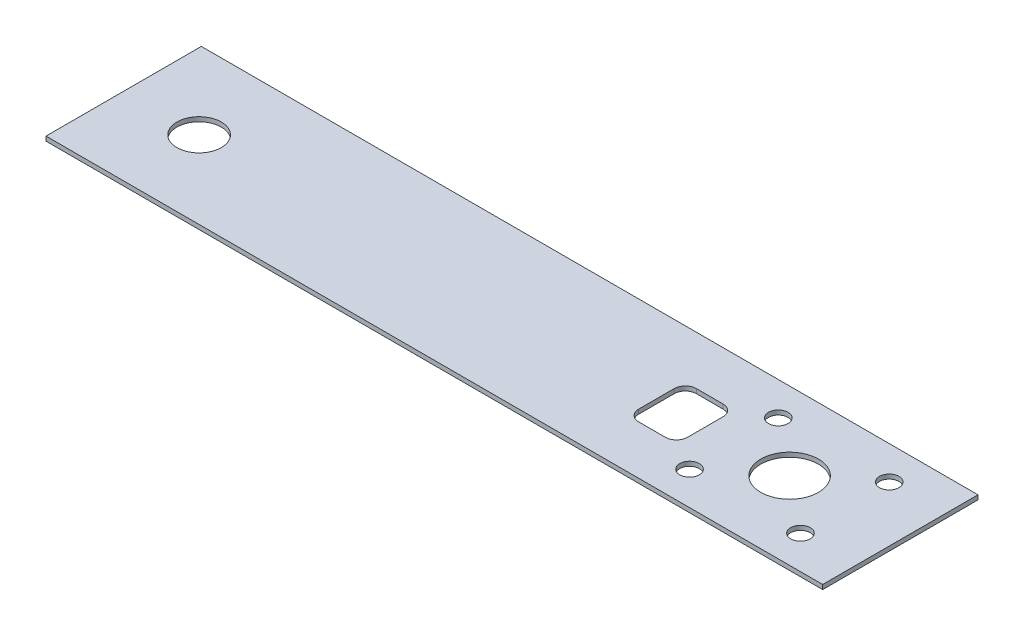
from build123d import *

# Parameters (mm, degrees)
SKETCH1_W           = 350
SKETCH1_H           = 70
SKETCH1_R           = 4.4
BOSS_EXTRUDE1_DEPTH = 2
CUT_EXTRUDE1_REACH  = 180.477
SKETCH2_R           = 13
CUT_EXTRUDE2_REACH  = 180.477
SKETCH3_R           = 10


with BuildPart() as part:
    # Sketch1 → Boss-Extrude1 (new body)
    with BuildSketch(Plane(origin=(0, 0, 0), x_dir=(1, 0, 0), z_dir=(0, 1, 0))):
        Rectangle(SKETCH1_W, SKETCH1_H)
        with Locations(Location((150, 20, 0), (0, 0, 270))):
            Circle(SKETCH1_R, mode=Mode.SUBTRACT)
        with Locations(Location((150, -20, 0), (0, 0, 90))):
            Circle(SKETCH1_R, mode=Mode.SUBTRACT)
        with Locations(Location((100, -20, 0), (0, 0, 270))):
            Circle(SKETCH1_R, mode=Mode.SUBTRACT)
        with Locations(Location((100, 20, 0), (0, 0, 90))):
            Circle(SKETCH1_R, mode=Mode.SUBTRACT)
        with BuildLine():
            Line((82.1, -13), (70.1, -13))
            ThreePointArc((70.1, -13), (66.564466094, -11.535533906), (65.1, -8))
            Line((65.1, -8), (65.1, 8))
            ThreePointArc((65.1, 8), (66.564466094, 11.535533906), (70.1, 13))
            Line((70.1, 13), (82.1, 13))
            ThreePointArc((82.1, 13), (85.635533906, 11.535533906), (87.1, 8))
            Line((87.1, 8), (87.1, -8))
            ThreePointArc((87.1, -8), (85.635533906, -11.535533906), (82.1, -13))
        make_face(mode=Mode.SUBTRACT)
    extrude(amount=BOSS_EXTRUDE1_DEPTH)

    # Sketch2 → Cut-Extrude1 (cut, up to next)
    with BuildSketch(Plane(origin=(0, 0, 0), x_dir=(1, 0, 0), z_dir=(0, 1, 0)), mode=Mode.PRIVATE) as cut_extrude1_sk1:
        with Locations(Location((125.1, 0, 0), (0, 0, 90))):
            Circle(SKETCH2_R)
    cut_extrude1_tool1 = extrude(cut_extrude1_sk1.sketch, amount=CUT_EXTRUDE1_REACH, mode=Mode.PRIVATE) & part.part
    add(cut_extrude1_tool1.solids().sort_by_distance((125.1, 0, 0))[0], mode=Mode.SUBTRACT)

    # Sketch3 → Cut-Extrude2 (cut, up to next)
    with BuildSketch(Plane(origin=(0, 0, 0), x_dir=(1, 0, 0), z_dir=(0, 1, 0)), mode=Mode.PRIVATE) as cut_extrude2_sk1:
        with Locations(Location((-141, 0, 0), (0, 0, 90))):
            Circle(SKETCH3_R)
    cut_extrude2_tool1 = extrude(cut_extrude2_sk1.sketch, amount=CUT_EXTRUDE2_REACH, mode=Mode.PRIVATE) & part.part
    add(cut_extrude2_tool1.solids().sort_by_distance((-141, 0, 0))[0], mode=Mode.SUBTRACT)


solid = part.part
